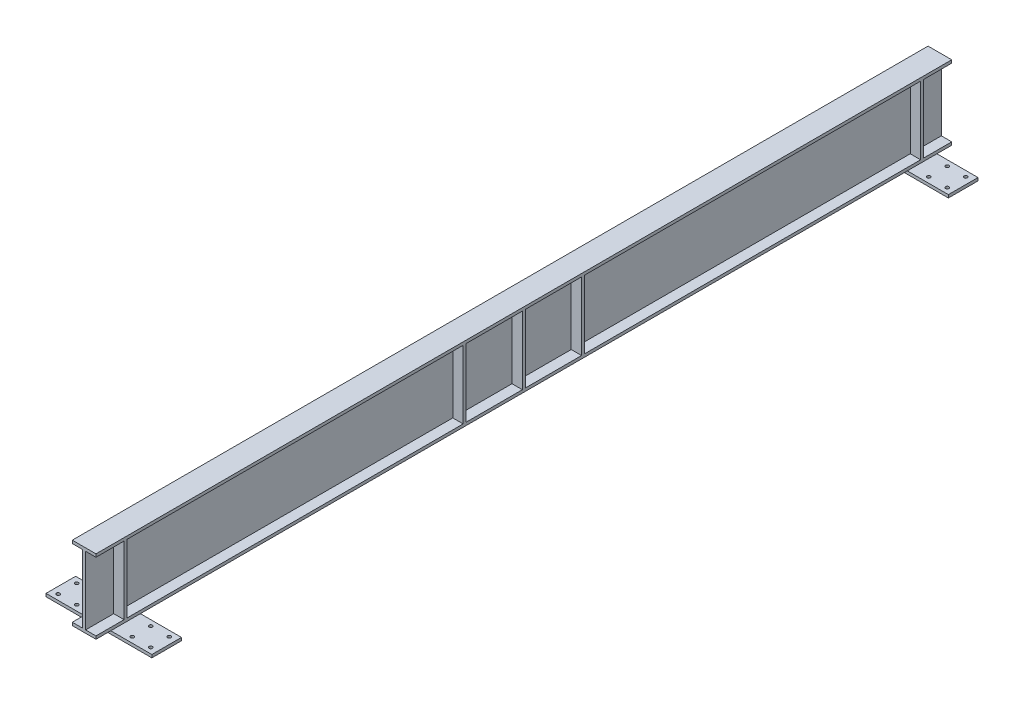
from build123d import *

# Parameters (mm, degrees)
EXTRUDE_1_DEPTH        = 5780
SKETCH_2_W             = 20
SKETCH_2_H             = 460
EXTRUDE_2_DEPTH        = 160
SKETCH_3_W             = 715
SKETCH_3_H             = 200
EXTRUDE_3_DEPTH        = 20
SKETCH_4_R             = 11.5
CUT_EXTRUDE_1_DEPTH    = 20
PATTERN_LINEAR_1_COUNT = 2
PATTERN_LINEAR_1_PITCH = 5380


with BuildPart() as part:
    # 草图1 → 凸台-拉伸1 (new body)
    with BuildSketch(Plane(origin=(0, 0, 0), x_dir=(1, 0, 0), z_dir=(0, 0, -1))):
        Polygon((0, 0), (160, 0), (160, 20), (90, 20), (90, 480), (160, 480), (160, 500), (0, 500), (0, 480), (70, 480), (70, 20), (0, 20), align=None)
    extrude(amount=EXTRUDE_1_DEPTH)

    # 草图2 → 凸台-拉伸2 (add)
    with BuildSketch(Plane(origin=(160, 0, 0), x_dir=(0, 0, -1), z_dir=(1, 0, 0))):
        with Locations((200, -250)):
            Rectangle(SKETCH_2_W, SKETCH_2_H)
        with Locations((2490, -250)):
            Rectangle(SKETCH_2_W, SKETCH_2_H)
        with Locations((2890, -250)):
            Rectangle(SKETCH_2_W, SKETCH_2_H)
        with Locations((3290, -250)):
            Rectangle(SKETCH_2_W, SKETCH_2_H)
        with Locations((5580, -250)):
            Rectangle(SKETCH_2_W, SKETCH_2_H)
    extrude(amount=-EXTRUDE_2_DEPTH)

    # 草图3 → 凸台-拉伸3 (add)
    with BuildSketch(Plane.XZ.offset(500)):
        with Locations((80, -5580)):
            Rectangle(SKETCH_3_W, SKETCH_3_H)
        with Locations((80, -200)):
            Rectangle(SKETCH_3_W, SKETCH_3_H)
    extrude(amount=EXTRUDE_3_DEPTH)

    # 草图4 → 切除-拉伸1 (cut)
    with BuildSketch(Plane.XZ.offset(520)):
        with Locations(Location((-232.5, -137.5, 0), (0, 0, 270))):
            Circle(SKETCH_4_R)
        with Locations(Location((-232.5, -262.5, 0), (0, 0, 270))):
            Circle(SKETCH_4_R)
        with Locations(Location((-107.5, -137.5, 0), (0, 0, 270))):
            Circle(SKETCH_4_R)
        with Locations(Location((-107.5, -262.5, 0), (0, 0, 270))):
            Circle(SKETCH_4_R)
        with Locations(Location((267.5, -137.5, 0), (0, 0, 270))):
            Circle(SKETCH_4_R)
        with Locations(Location((267.5, -262.5, 0), (0, 0, 270))):
            Circle(SKETCH_4_R)
        with Locations(Location((392.5, -137.5, 0), (0, 0, 270))):
            Circle(SKETCH_4_R)
        with Locations(Location((392.5, -262.5, 0), (0, 0, 270))):
            Circle(SKETCH_4_R)
    cut_extrude_1 = extrude(amount=-CUT_EXTRUDE_1_DEPTH, mode=Mode.SUBTRACT)

    # 阵列(线性)1: 切除-拉伸1 ×2
    with Locations(*[(0, 0, -i * PATTERN_LINEAR_1_PITCH) for i in range(1, PATTERN_LINEAR_1_COUNT)]):
        add(cut_extrude_1, mode=Mode.SUBTRACT)


solid = part.part
